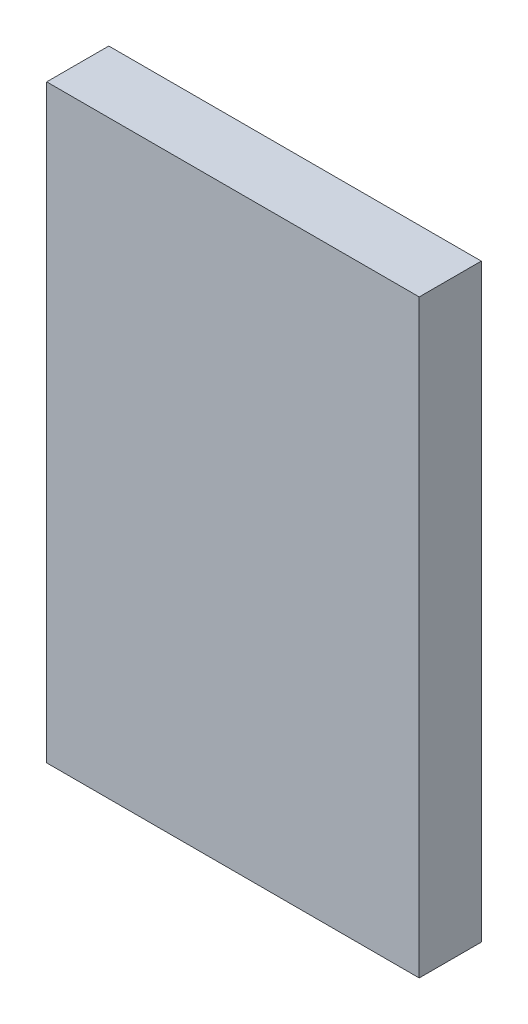
from build123d import *

# Parameters (mm, degrees)
SKETCH1_W           = 24
SKETCH1_H           = 38
BOSS_EXTRUDE1_DEPTH = 4


with BuildPart() as part:
    # Sketch1 → Boss-Extrude1 (new body)
    with BuildSketch(Plane.XY):
        Rectangle(SKETCH1_W, SKETCH1_H)
    extrude(amount=BOSS_EXTRUDE1_DEPTH)


solid = part.part
